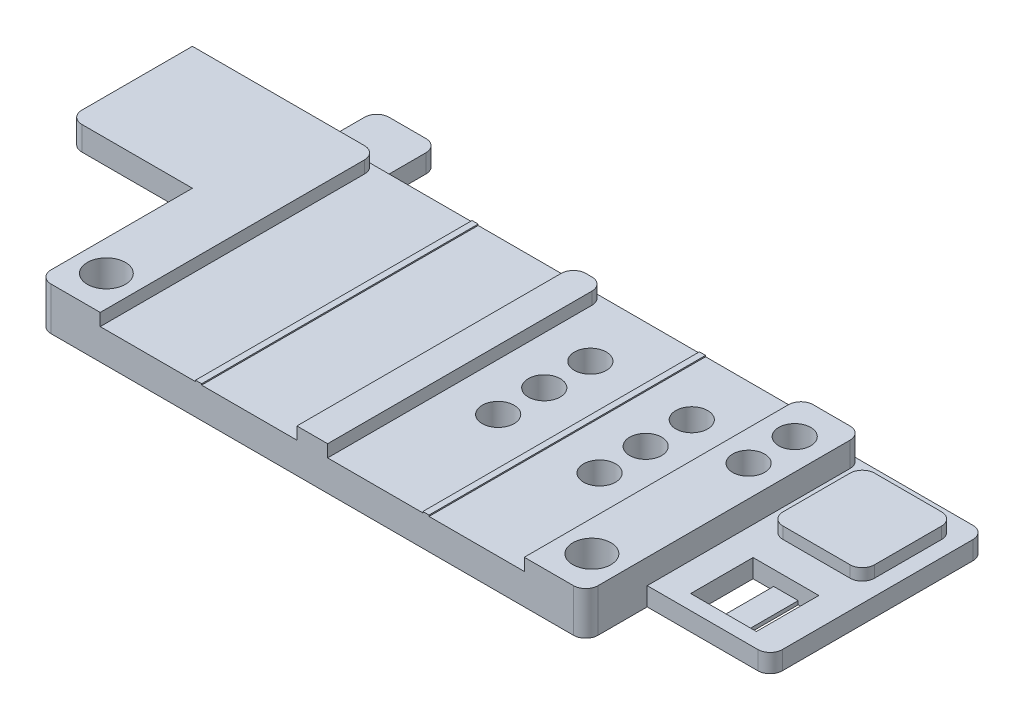
from build123d import *

# Parameters (mm, degrees)
SKETCH1_W             = 15.5
SKETCH1_H             = 45
BOSS_EXTRUDE1_DEPTH   = 5
BOSS_EXTRUDE1_2_DEPTH = 5
SKETCH1_R             = 2.6
BOSS_EXTRUDE1_3_DEPTH = 5
BOSS_EXTRUDE1_4_DEPTH = 5
SKETCH1_3_W           = 1
SKETCH1_3_H           = 45
BOSS_EXTRUDE2_DEPTH   = 5.2
SKETCH1_4_W           = 5
SKETCH1_4_H           = 45
SKETCH1_4_W_2         = 10
SKETCH1_4_R           = 2.6
BOSS_EXTRUDE3_DEPTH   = 7
SKETCH2_W             = 7.5
SKETCH2_H             = 15
CUT_EXTRUDE1_DEPTH    = 1.1
SKETCH3_R             = 3.1
CUT_EXTRUDE2_DEPTH    = 152.506600516
SKETCH5_W             = 20
SKETCH5_H             = 20
SKETCH5_W_2           = 14.9
SKETCH5_H_2           = 14.9
BOSS_EXTRUDE4_DEPTH   = 3
SKETCH5_3_W           = 14.9
SKETCH5_3_H           = 14.9
BOSS_EXTRUDE5_DEPTH   = 4.9
BOSS_EXTRUDE6_START   = 7
SKETCH5_4_W           = 20
SKETCH5_4_H           = 20
SKETCH5_4_W_2         = 15.2
SKETCH5_4_H_2         = 15.2
BOSS_EXTRUDE6_DEPTH   = 3.9
BOSS_EXTRUDE7_START   = 7
SKETCH5_5_W           = 15.2
SKETCH5_5_H           = 15.2
BOSS_EXTRUDE7_DEPTH   = 1
FILLET1_R             = 2
BOSS_EXTRUDE8_START   = -7
SKETCH6_W             = 10
SKETCH6_H             = 10
BOSS_EXTRUDE8_DEPTH   = 3
CHAMFER1_SIZE         = 1
SKETCH8_W             = 20
SKETCH8_H             = 15
SKETCH8_W_2           = 10.7
SKETCH8_H_2           = 10.15
BOSS_EXTRUDE9_DEPTH   = 3
SKETCH8_3_W           = 4
SKETCH8_3_H           = 10.15
BOSS_EXTRUDE10_DEPTH  = 0.6
FILLET3_R             = 2


with BuildPart() as part:
    # Sketch1 → Boss-Extrude1 (new body)
    with BuildSketch(Plane(origin=(0, 0, 0), x_dir=(1, 0, 0), z_dir=(0, 1, 0))):
        with Locations((73.25, 22.5)):
            Rectangle(SKETCH1_W, SKETCH1_H)
    extrude(amount=BOSS_EXTRUDE1_DEPTH)



with BuildPart() as body_2:
    # Sketch1 → Boss-Extrude1 2 (new body)
    with BuildSketch(Plane(origin=(0, 0, 0), x_dir=(1, 0, 0), z_dir=(0, 1, 0))):
        with Locations((89.75, 22.5)):
            Rectangle(SKETCH1_W, SKETCH1_H)
    extrude(amount=BOSS_EXTRUDE1_2_DEPTH)


with BuildPart() as body_3:
    # Sketch1 → Boss-Extrude1 3 (new body)
    with BuildSketch(Plane(origin=(0, 0, 0), x_dir=(1, 0, 0), z_dir=(0, 1, 0))):
        with Locations((110.25, 22.5)):
            Rectangle(SKETCH1_W, SKETCH1_H)
        with Locations(Location((110.25, 20, 0), (0, 0, 270))):
            Circle(SKETCH1_R, mode=Mode.SUBTRACT)
        with Locations(Location((110.25, 27.5, 0), (0, 0, 270))):
            Circle(SKETCH1_R, mode=Mode.SUBTRACT)
        with Locations(Location((110.25, 35, 0), (0, 0, 270))):
            Circle(SKETCH1_R, mode=Mode.SUBTRACT)
    extrude(amount=BOSS_EXTRUDE1_3_DEPTH)


with BuildPart() as body_4:
    # Sketch1 → Boss-Extrude1 4 (new body)
    with BuildSketch(Plane(origin=(0, 0, 0), x_dir=(1, 0, 0), z_dir=(0, 1, 0))):
        with Locations((126.75, 22.5)):
            Rectangle(SKETCH1_W, SKETCH1_H)
        with Locations(Location((126.75, 20, 0), (0, 0, 270))):
            Circle(SKETCH1_R, mode=Mode.SUBTRACT)
        with Locations(Location((126.75, 27.5, 0), (0, 0, 270))):
            Circle(SKETCH1_R, mode=Mode.SUBTRACT)
        with Locations(Location((126.75, 35, 0), (0, 0, 270))):
            Circle(SKETCH1_R, mode=Mode.SUBTRACT)
    extrude(amount=BOSS_EXTRUDE1_4_DEPTH)


with BuildPart() as part_1:
    add(part.part)

    add(body_2.part)  # Boss-Extrude2 merges body 2

    add(body_3.part)  # Boss-Extrude2 merges body 3

    add(body_4.part)  # Boss-Extrude2 merges body 4
    # Sketch1<3> → Boss-Extrude2 (add)
    with BuildSketch(Plane(origin=(0, 0, 0), x_dir=(1, 0, 0), z_dir=(0, 1, 0))):
        with Locations((81.5, 22.5)):
            Rectangle(SKETCH1_3_W, SKETCH1_3_H)
        with Locations((118.5, 22.5)):
            Rectangle(SKETCH1_3_W, SKETCH1_3_H)
    extrude(amount=BOSS_EXTRUDE2_DEPTH)

    # Sketch1<4> → Boss-Extrude3 (add)
    # profile 1 of 3: a face of its own
    with BuildSketch(Plane(origin=(0, 0, 0), x_dir=(1, 0, 0), z_dir=(0, 1, 0))):
        with Locations((100, 22.5)):
            Rectangle(SKETCH1_4_W, SKETCH1_4_H)
    # profile 2 of 3: a face of its own
    with BuildSketch(Plane(origin=(0, 0, 0), x_dir=(1, 0, 0), z_dir=(0, 1, 0))):
        with Locations((139.5, 22.5)):
            Rectangle(SKETCH1_4_W_2, SKETCH1_4_H)
        with Locations(Location((139.5, 31.5, 0), (0, 0, 270))):
            Circle(SKETCH1_4_R, mode=Mode.SUBTRACT)
        with Locations(Location((139.5, 39, 0), (0, 0, 270))):
            Circle(SKETCH1_4_R, mode=Mode.SUBTRACT)
    # profile 3 of 3: a face of its own
    with BuildSketch(Plane(origin=(0, 0, 0), x_dir=(1, 0, 0), z_dir=(0, 1, 0))):
        with Locations((60.5, 22.5)):
            Rectangle(SKETCH1_4_W_2, SKETCH1_4_H)
    extrude(amount=BOSS_EXTRUDE3_DEPTH)

    # Sketch2 → Cut-Extrude1 (cut)
    with BuildSketch(Plane(origin=(0, 0, 0), x_dir=(-1, 0, 0), z_dir=(0, -1, 0))):
        with Locations((-139.5, 35.25)):
            Rectangle(SKETCH2_W, SKETCH2_H)
    extrude(amount=-CUT_EXTRUDE1_DEPTH, mode=Mode.SUBTRACT)

    # Sketch3 → Cut-Extrude2 (cut, through all)
    with BuildSketch(Plane(origin=(0, 7, 0), x_dir=(1, 0, 0), z_dir=(0, 1, 0))):
        with Locations(Location((60.5, 6, 0), (0, 0, 270))):
            Circle(SKETCH3_R)
        with Locations(Location((139.5, 6, 0), (0, 0, 90))):
            Circle(SKETCH3_R)
    extrude(amount=-CUT_EXTRUDE2_DEPTH, mode=Mode.SUBTRACT)

    # Sketch5 → Boss-Extrude4 (add)
    # profile 1 of 2: a face of its own
    with BuildSketch(Plane(origin=(0, 0, 0), x_dir=(1, 0, 0), z_dir=(0, 1, 0))):
        with Locations((154.5, 35)):
            Rectangle(SKETCH5_W, SKETCH5_H)
        with Locations((154.5, 35)):
            Rectangle(SKETCH5_W_2, SKETCH5_H_2, mode=Mode.SUBTRACT)
    # profile 2 of 2: a face of its own
    with BuildSketch(Plane(origin=(0, 0, 0), x_dir=(1, 0, 0), z_dir=(0, 1, 0))):
        with Locations((154.5, 35)):
            Rectangle(SKETCH5_W_2, SKETCH5_H_2)
    extrude(amount=BOSS_EXTRUDE4_DEPTH)

    # Sketch5<3> → Boss-Extrude5 (add)
    with BuildSketch(Plane(origin=(0, 0, 0), x_dir=(1, 0, 0), z_dir=(0, 1, 0))):
        with Locations((154.5, 35)):
            Rectangle(SKETCH5_3_W, SKETCH5_3_H)
    extrude(amount=BOSS_EXTRUDE5_DEPTH)

    # Sketch5<4> → Boss-Extrude6 (add)
    with BuildSketch(Plane(origin=(0, 0, 0), x_dir=(1, 0, 0), z_dir=(0, 1, 0)).offset(BOSS_EXTRUDE6_START)):
        with Locations((45.5, 35)):
            Rectangle(SKETCH5_4_W, SKETCH5_4_H)
        with Locations((45.5, 35)):
            Rectangle(SKETCH5_4_W_2, SKETCH5_4_H_2, mode=Mode.SUBTRACT)
    extrude(amount=-BOSS_EXTRUDE6_DEPTH)

    # Sketch5<5> → Boss-Extrude7 (add)
    with BuildSketch(Plane(origin=(0, 0, 0), x_dir=(1, 0, 0), z_dir=(0, 1, 0)).offset(BOSS_EXTRUDE7_START)):
        with Locations((45.5, 35)):
            Rectangle(SKETCH5_5_W, SKETCH5_5_H)
    extrude(amount=-BOSS_EXTRUDE7_DEPTH)

    # Fillet1
    fillet1_edges = [part_1.edges().sort_by_distance(p)[0] for p in [
        (161.95, 3.95, -42.45),
        (147.05, 3.95, -42.45),
        (147.05, 3.95, -27.55),
        (161.95, 3.95, -27.55),
    ]]
    fillet(fillet1_edges, radius=FILLET1_R)

    # Sketch6 → Boss-Extrude8 (add)
    with BuildSketch(Plane(origin=(0, 7, 0), x_dir=(1, 0, 0), z_dir=(0, 1, 0)).offset(BOSS_EXTRUDE8_START)):
        with Locations((60.5, 50)):
            Rectangle(SKETCH6_W, SKETCH6_H)
    extrude(amount=BOSS_EXTRUDE8_DEPTH)

    # Chamfer1
    chamfer1_edges = [part_1.edges().sort_by_distance(p)[0] for p in [
        (45.5, 3.1, -45),
    ]]
    chamfer(chamfer1_edges, length=CHAMFER1_SIZE)

    # Sketch8 → Boss-Extrude9 (add)
    with BuildSketch(Plane(origin=(0, 0, 0), x_dir=(1, 0, 0), z_dir=(0, 1, 0))):
        with Locations((154.5, 17.5)):
            Rectangle(SKETCH8_W, SKETCH8_H)
        with Locations((154.5, 17.5)):
            Rectangle(SKETCH8_W_2, SKETCH8_H_2, mode=Mode.SUBTRACT)
    extrude(amount=BOSS_EXTRUDE9_DEPTH)

    # Sketch8<3> → Boss-Extrude10 (add)
    with BuildSketch(Plane(origin=(0, 0, 0), x_dir=(1, 0, 0), z_dir=(0, 1, 0))):
        with Locations((154.5, 17.5)):
            Rectangle(SKETCH8_3_W, SKETCH8_3_H)
    extrude(amount=BOSS_EXTRUDE10_DEPTH)

    # Fillet3
    fillet3_edges = [part_1.edges().sort_by_distance(p)[0] for p in [
        (164.5, 1.5, -45),
        (35.5, 5.05, -25),
        (65.5, 1.5, -55),
        (55.5, 1.5, -55),
        (164.5, 1.5, -10),
        (97.5, 6, -45),
        (102.5, 6, -45),
        (134.5, 6, -45),
        (144.5, 3.5, 0),
        (144.5, 5, -45),
        (55.5, 3.5, 0),
        (65.5, 6, -45),
    ]]
    fillet(fillet3_edges, radius=FILLET3_R)


solid = part_1.part
